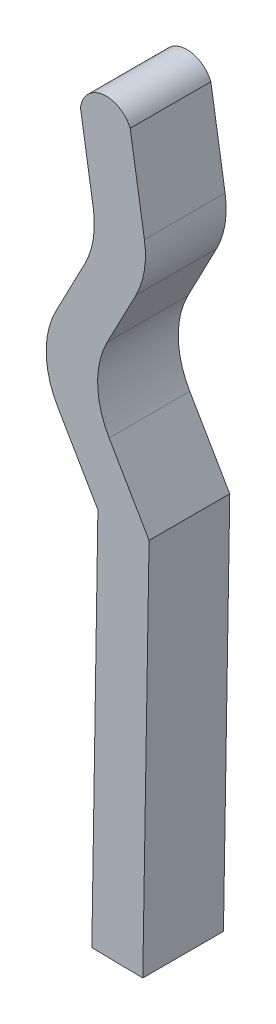
from build123d import *

# Parameters (mm, degrees)
EXTRUDE_1_DEPTH = 19


with BuildPart() as part:
    # Эскиз1 → Вытянуть1 (new body)
    with BuildSketch(Plane.XY):
        with BuildLine():
            Line((-5.996779713, 0.196552972), (-4.569380805, 90.185232995))
            Line((-4.569380805, 90.185232995), (-14.032554186, 106.456860521))
            ThreePointArc((-14.032554186, 106.456860521), (-16.738501903, 116.052970381), (-14.475382715, 125.763056325))
            Line((-14.475382715, 125.763056325), (-7.67310326, 138.800500371))
            ThreePointArc((-7.67310326, 138.800500371), (-5.665255915, 144.834300954), (-5.652980092, 151.193392849))
            Line((-5.652980092, 151.193392849), (-8.669783562, 170.161558564))
            ThreePointArc((-8.669783562, 170.161558564), (-3.453313414, 175.494197645), (3.037538011, 171.817589403))
            Line((3.037538011, 171.817589403), (6.382811975, 150.78416394))
            ThreePointArc((6.382811975, 150.78416394), (6.370536152, 144.425072045), (4.362688807, 138.391271463))
            Line((4.362688807, 138.391271463), (-2.373176384, 125.481118902))
            ThreePointArc((-2.373176384, 125.481118902), (-4.636295572, 115.771032958), (-1.930347854, 106.174923097))
            Line((-1.930347854, 106.174923097), (7.483697652, 89.987769398))
            Line((7.483697652, 89.987769398), (6, 0))
            Line((6, 0), (-5.996779713, 0.196552972))
        make_face()
    extrude(amount=EXTRUDE_1_DEPTH)


solid = part.part
